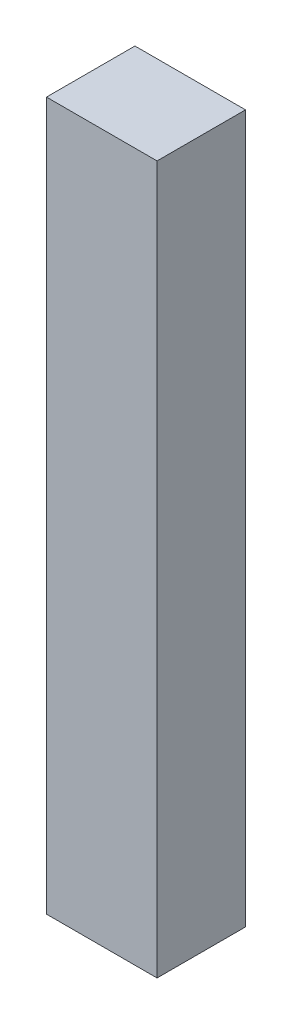
from build123d import *

# Parameters (mm, degrees)
SKETCH1_W           = 250
SKETCH1_H           = 1600
BOSS_EXTRUDE1_DEPTH = 200


with BuildPart() as part:
    # Sketch1 → Boss-Extrude1 (new body)
    with BuildSketch(Plane.XY):
        Rectangle(SKETCH1_W, SKETCH1_H)
    extrude(amount=BOSS_EXTRUDE1_DEPTH)


solid = part.part
